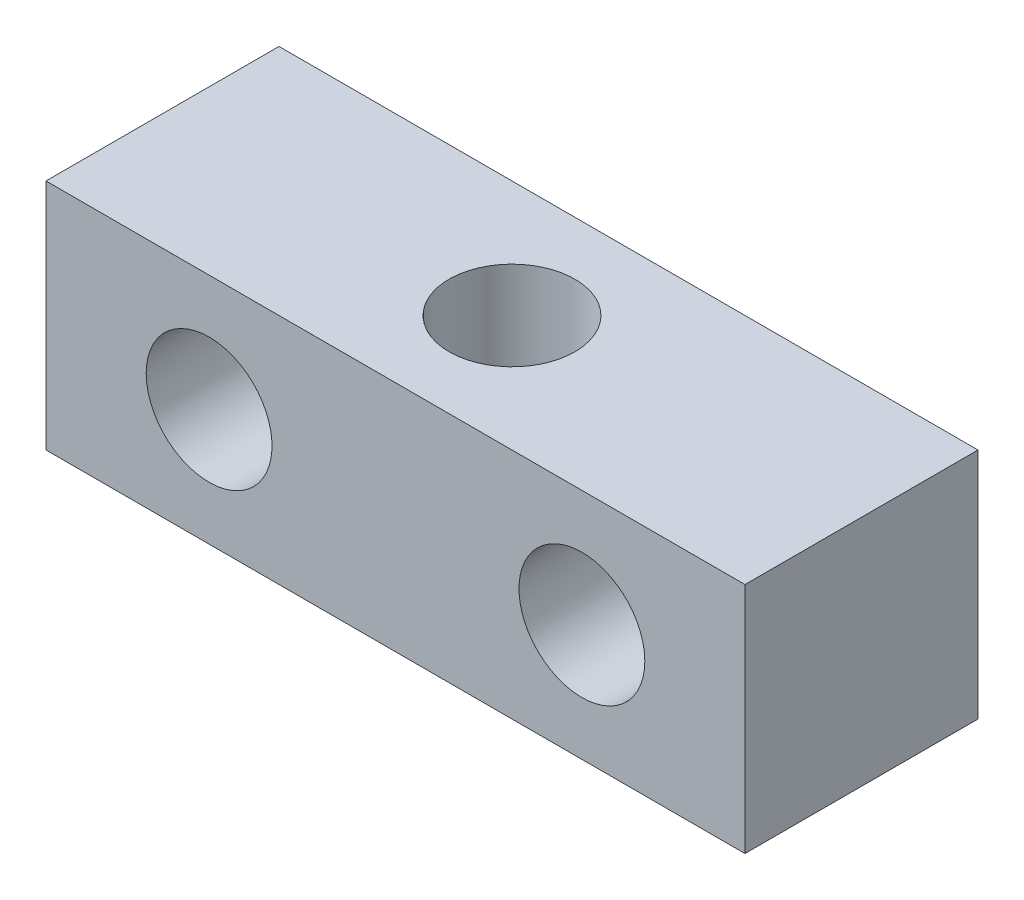
from build123d import *

# Parameters (mm, degrees)
SKETCH1_W           = 38.1
SKETCH1_H           = 12.7
BOSS_EXTRUDE1_DEPTH = 12.7
SKETCH2_R           = 3.429
CUT_EXTRUDE1_DEPTH  = 12.7
SKETCH3_R           = 3.429
CUT_EXTRUDE2_DEPTH  = 12.7


with BuildPart() as part:
    # Sketch1 → Boss-Extrude1 (new body)
    with BuildSketch(Plane.XY):
        Rectangle(SKETCH1_W, SKETCH1_H)
    extrude(amount=BOSS_EXTRUDE1_DEPTH)

    # Sketch2 → Cut-Extrude1 (cut)
    with BuildSketch(Plane.XY.offset(12.7)):
        with Locations((10.16, 0)):
            Circle(SKETCH2_R)
    cut_extrude1 = extrude(amount=-CUT_EXTRUDE1_DEPTH, mode=Mode.SUBTRACT)

    # Sketch3 → Cut-Extrude2 (cut)
    with BuildSketch(Plane(origin=(0, 6.35, 0), x_dir=(1, 0, 0), z_dir=(0, 1, 0))):
        with Locations(Location((0, -6.35, 0), (0, 0, 270))):
            Circle(SKETCH3_R)
    extrude(amount=-CUT_EXTRUDE2_DEPTH, mode=Mode.SUBTRACT)

    # Mirror1: Cut-Extrude1 across plane
    add(cut_extrude1.mirror(Plane(origin=(0, 0, 0), x_dir=(0, 0, 1), z_dir=(1, 0, 0))), mode=Mode.SUBTRACT)


solid = part.part
